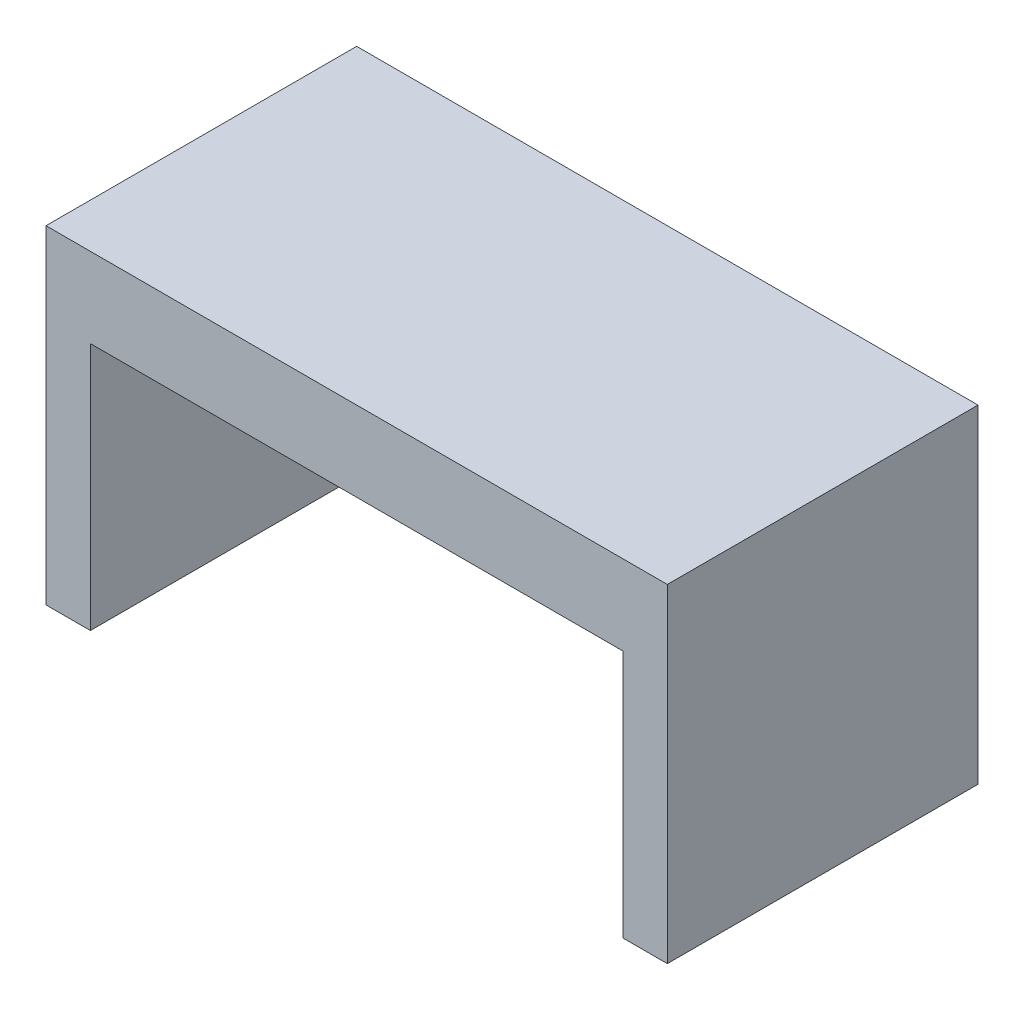
from build123d import *

# Parameters (mm, degrees)
ESTRUSIONE_ESTRUSIONE1_DEPTH = 700


with BuildPart() as part:
    # Schizzo1 → Estrusione-Estrusione1 (new body)
    with BuildSketch(Plane.XY):
        Polygon((-100, 0), (0, 0), (0, 560), (1200, 560), (1200, 0), (1300, 0), (1300, 740), (-100, 740), align=None)
    extrude(amount=ESTRUSIONE_ESTRUSIONE1_DEPTH)


solid = part.part
